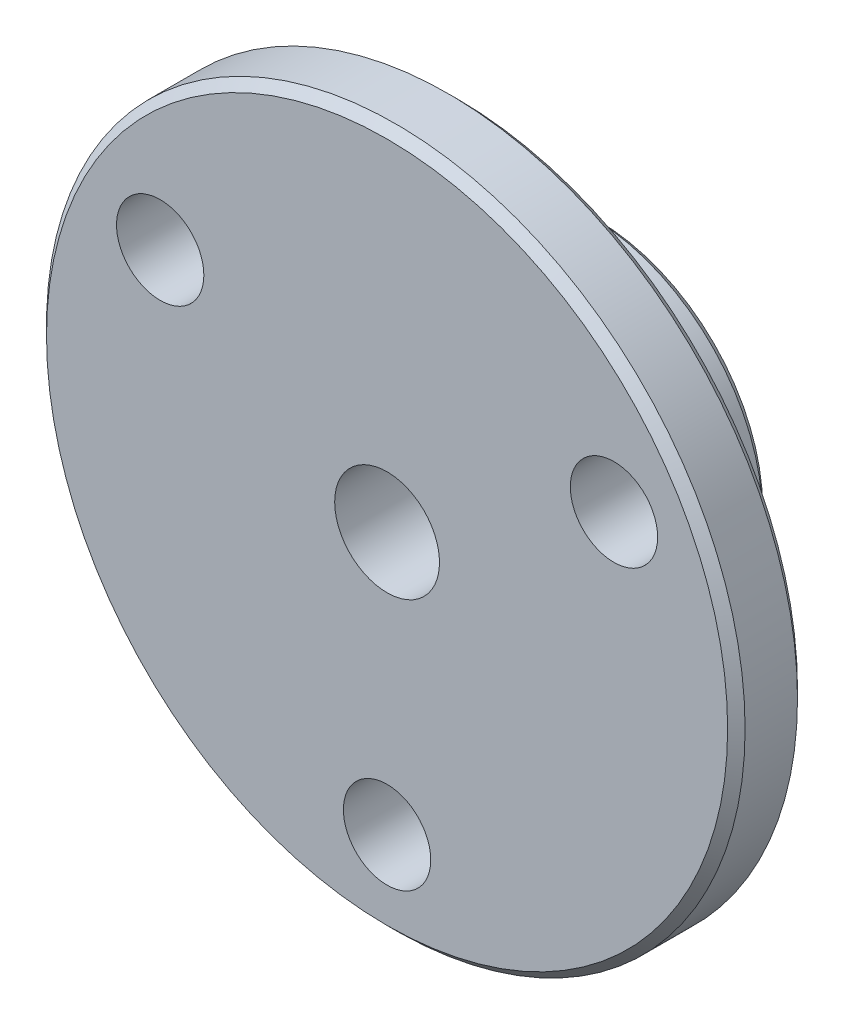
from build123d import *

# Parameters (mm, degrees)
SKETCH1_R           = 5
BOSS_EXTRUDE1_DEPTH = 4
SKETCH2_R           = 10
SKETCH2_R_2         = 1.25
BOSS_EXTRUDE2_DEPTH = 2
SKETCH3_R           = 1.5
CUT_EXTRUDE1_DEPTH  = 16.362291496
CHAMFER1_SIZE       = 0.25


with BuildPart() as part:
    # Sketch1 → Boss-Extrude1 (new body)
    with BuildSketch(Plane.XY):
        Circle(SKETCH1_R)
    extrude(amount=-BOSS_EXTRUDE1_DEPTH)

    # Sketch2 → Boss-Extrude2 (add)
    with BuildSketch(Plane.XY):
        Circle(SKETCH2_R)
        with Locations((-6.495190528, 3.75)):
            Circle(SKETCH2_R_2, mode=Mode.SUBTRACT)
        with Locations((6.495190528, 3.75)):
            Circle(SKETCH2_R_2, mode=Mode.SUBTRACT)
        with Locations((0, -7.5)):
            Circle(SKETCH2_R_2, mode=Mode.SUBTRACT)
    extrude(amount=BOSS_EXTRUDE2_DEPTH)

    # Sketch3 → Cut-Extrude1 (cut, through all)
    with BuildSketch(Plane(origin=(0, 0, -4), x_dir=(-1, 0, 0), z_dir=(0, 0, -1))):
        Circle(SKETCH3_R)
    extrude(amount=-CUT_EXTRUDE1_DEPTH, mode=Mode.SUBTRACT)

    # Chamfer1
    chamfer1_edges = [part.edges().sort_by_distance(p)[0] for p in [
        (-5, 0, 0),
        (-5, 0, -4),
        (-10, 0, 2),
        (-10, 0, 0),
    ]]
    chamfer(chamfer1_edges, length=CHAMFER1_SIZE)


solid = part.part
